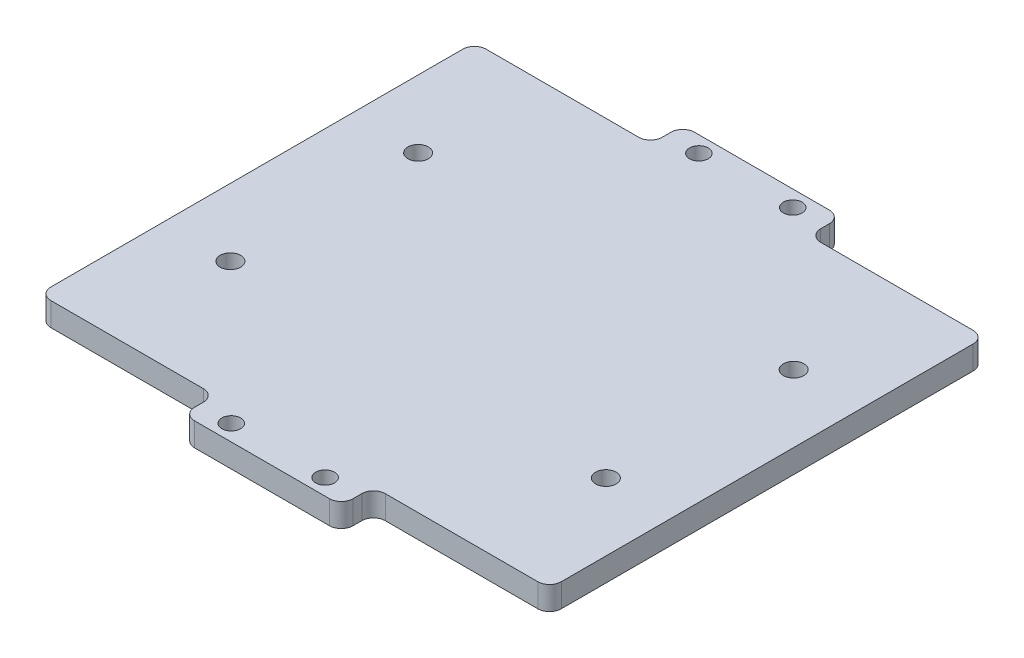
from build123d import *

# Parameters (mm, degrees)
SKETCH_1_W          = 87
SKETCH_1_H          = 85.2
EXTRUDE_1_DEPTH     = 4
SKETCH_2_W          = 60
SKETCH_2_H          = 11
CUT_EXTRUDE_1_DEPTH = 4
SKETCH_3_R          = 1.75
CUT_EXTRUDE_2_DEPTH = 4
SKETCH_4_R          = 1.6
CUT_EXTRUDE_3_DEPTH = 4
FILLET_3_R          = 2


with BuildPart() as part:
    # 草图1 → 凸台-拉伸1 (new body)
    with BuildSketch(Plane(origin=(0, 0, 0), x_dir=(1, 0, 0), z_dir=(0, 1, 0))):
        Rectangle(SKETCH_1_W, SKETCH_1_H)
    extrude(amount=EXTRUDE_1_DEPTH)

    # 草图2 → 切除-拉伸1 (cut)
    with BuildSketch(Plane(origin=(0, 4, 0), x_dir=(1, 0, 0), z_dir=(0, 1, 0))):
        with Locations((-43.5, 42.6)):
            Rectangle(SKETCH_2_W, SKETCH_2_H)
        with Locations((43.5, 42.6)):
            Rectangle(SKETCH_2_W, SKETCH_2_H)
        with Locations((43.5, -42.6)):
            Rectangle(SKETCH_2_W, SKETCH_2_H)
        with Locations((-43.5, -42.6)):
            Rectangle(SKETCH_2_W, SKETCH_2_H)
    extrude(amount=-CUT_EXTRUDE_1_DEPTH, mode=Mode.SUBTRACT)

    # 草图3 → 切除-拉伸2 (cut)
    with BuildSketch(Plane(origin=(0, 4, 0), x_dir=(1, 0, 0), z_dir=(0, 1, 0))):
        with Locations(Location((-32, 16, 0), (0, 0, 270))):
            Circle(SKETCH_3_R)
        with Locations(Location((32, 16, 0), (0, 0, 270))):
            Circle(SKETCH_3_R)
        with Locations(Location((-32, -16, 0), (0, 0, 270))):
            Circle(SKETCH_3_R)
        with Locations(Location((32, -16, 0), (0, 0, 270))):
            Circle(SKETCH_3_R)
    extrude(amount=-CUT_EXTRUDE_2_DEPTH, mode=Mode.SUBTRACT)

    # 草图4 → 切除-拉伸3 (cut)
    with BuildSketch(Plane(origin=(0, 4, 0), x_dir=(1, 0, 0), z_dir=(0, 1, 0))):
        with Locations(Location((-8, 39.85, 0), (0, 0, 270))):
            Circle(SKETCH_4_R)
        with Locations(Location((8, 39.85, 0), (0, 0, 270))):
            Circle(SKETCH_4_R)
        with Locations(Location((8, -39.85, 0), (0, 0, 90))):
            Circle(SKETCH_4_R)
        with Locations(Location((-8, -39.85, 0), (0, 0, 90))):
            Circle(SKETCH_4_R)
    extrude(amount=-CUT_EXTRUDE_3_DEPTH, mode=Mode.SUBTRACT)

    # 圆角3
    fillet_3_edges = [part.edges().sort_by_distance(p)[0] for p in [
        (-13.5, 2, -42.6),
        (-43.5, 2, -37.1),
        (-13.5, 2, -37.1),
        (43.5, 2, -37.1),
        (13.5, 2, -42.6),
        (13.5, 2, -37.1),
        (43.5, 2, 37.1),
        (13.5, 2, 37.1),
        (13.5, 2, 42.6),
        (-43.5, 2, 37.1),
        (-13.5, 2, 42.6),
        (-13.5, 2, 37.1),
    ]]
    fillet(fillet_3_edges, radius=FILLET_3_R)


solid = part.part
